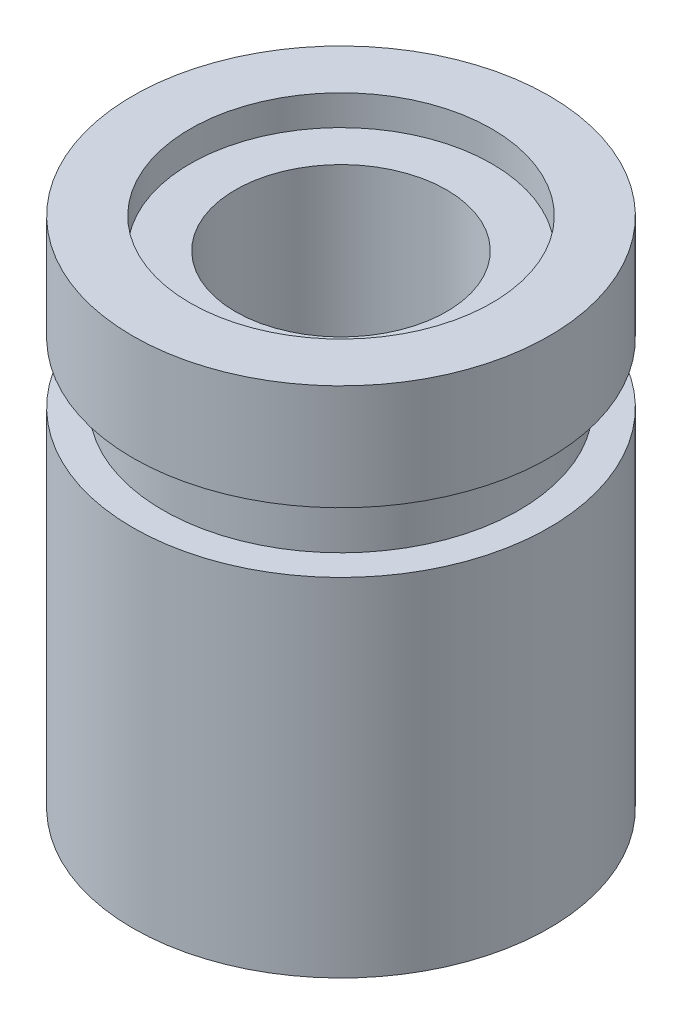
from build123d import *

# Parameters (mm, degrees)
SKETCH_1_R          = 6.9
SKETCH_1_R_2        = 2.5
EXTRUDE_1_DEPTH     = 17
SKETCH_2_R          = 3.5
CUT_EXTRUDE_1_DEPTH = 8.5
SKETCH_3_R          = 5
CUT_EXTRUDE_2_DEPTH = 1
SKETCH_4_W          = 2.072752753
SKETCH_4_H          = 2


with BuildPart() as part:
    # 草图1 → 凸台-拉伸1 (new body)
    with BuildSketch(Plane(origin=(0, 0, 0), x_dir=(1, 0, 0), z_dir=(0, 1, 0))):
        with Locations(Location((0, 0, 0), (0, 0, 270))):
            Circle(SKETCH_1_R)
        with Locations(Location((0, 0, 0), (0, 0, 270))):
            Circle(SKETCH_1_R_2, mode=Mode.SUBTRACT)
    extrude(amount=EXTRUDE_1_DEPTH)

    # 草图2 → 切除-拉伸1 (cut)
    with BuildSketch(Plane(origin=(0, 17, 0), x_dir=(1, 0, 0), z_dir=(0, 1, 0))):
        with Locations(Location((0, 0, 0), (0, 0, 270))):
            Circle(SKETCH_2_R)
    extrude(amount=-CUT_EXTRUDE_1_DEPTH, mode=Mode.SUBTRACT)

    # 草图3 → 切除-拉伸2 (cut)
    with BuildSketch(Plane(origin=(0, 17, 0), x_dir=(1, 0, 0), z_dir=(0, 1, 0))):
        with Locations(Location((0, 0, 0), (0, 0, 270))):
            Circle(SKETCH_3_R)
    extrude(amount=-CUT_EXTRUDE_2_DEPTH, mode=Mode.SUBTRACT)

    # 草图4 → 切除-旋转1 (revolve, cut)
    with BuildSketch(Plane.XY, mode=Mode.PRIVATE) as cut_revolve_1_sk:
        with Locations((6.936376377, 12.5)):
            Rectangle(SKETCH_4_W, SKETCH_4_H)
    revolve(cut_revolve_1_sk.sketch.rotate(Axis((0, 0, 0), (0, 1, 0)), 90), axis=Axis((0, 0, 0), (0, 1, 0)), mode=Mode.SUBTRACT)


solid = part.part
